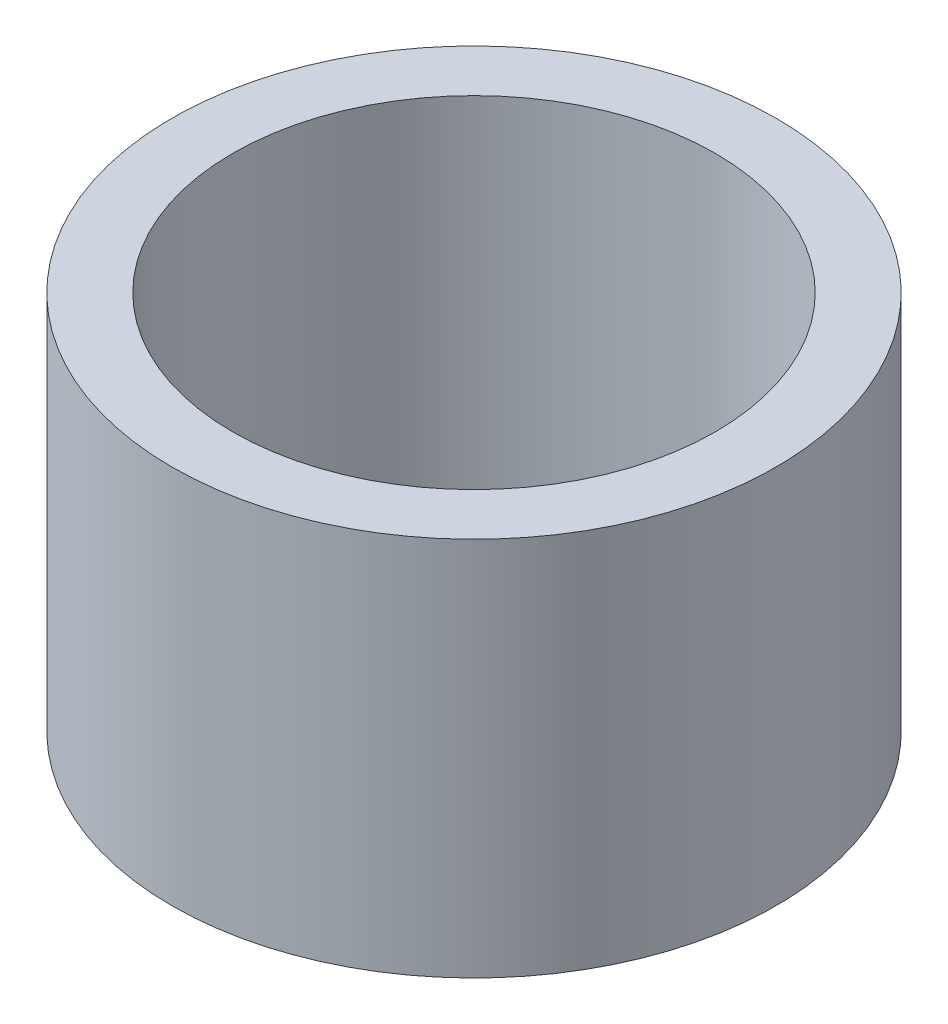
from build123d import *

# Parameters (mm, degrees)
SKETCH1_R           = 39.75
SKETCH1_R_2         = 31.75
BOSS_EXTRUDE1_DEPTH = 50


with BuildPart() as part:
    # Sketch1 → Boss-Extrude1 (new body)
    with BuildSketch(Plane(origin=(0, 0, 0), x_dir=(1, 0, 0), z_dir=(0, 1, 0))):
        with Locations(Location((0, 0, 0), (0, 0, 270))):
            Circle(SKETCH1_R)
        with Locations(Location((0, 0, 0), (0, 0, 270))):
            Circle(SKETCH1_R_2, mode=Mode.SUBTRACT)
    extrude(amount=BOSS_EXTRUDE1_DEPTH)


solid = part.part
